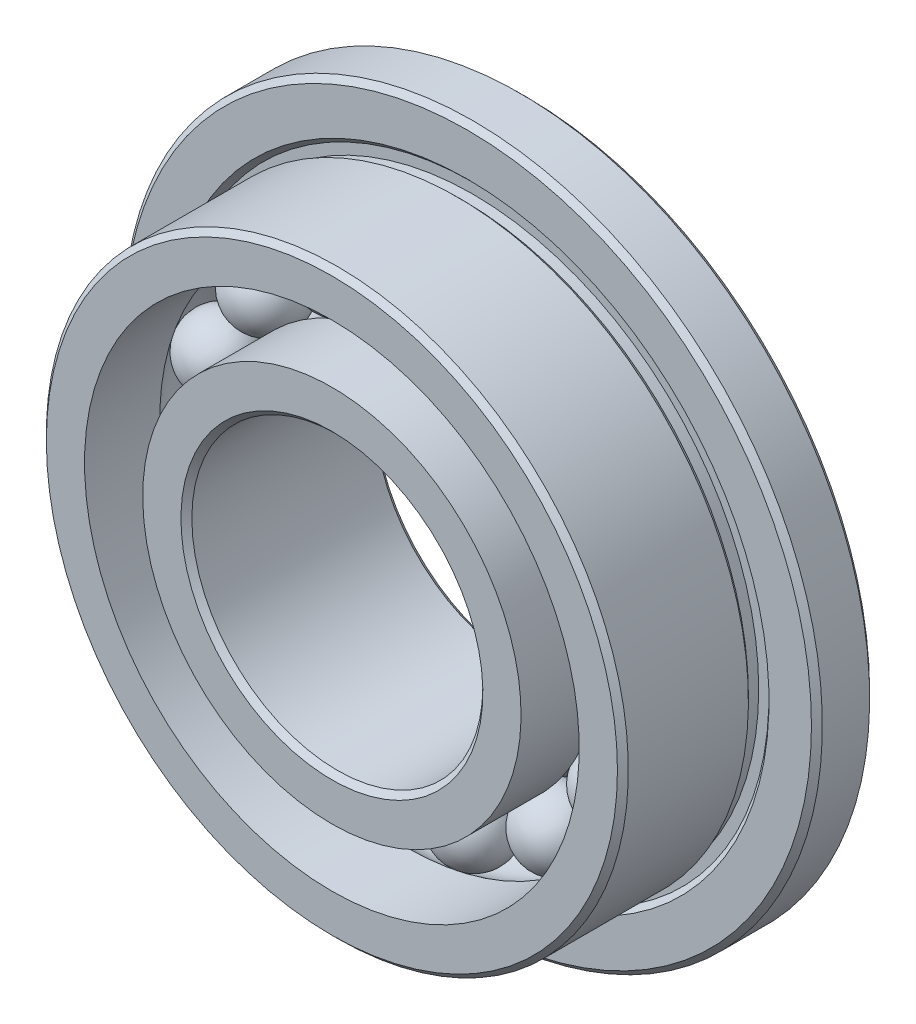
from build123d import *

# Parameters (mm, degrees)
FILLET1_SIZE      = 0.05625
FILLET2_SIZE      = 0.05625
CIRPATTERN3_COUNT = 15


with BuildPart() as part:
    # Sketch2 → Revolve1 (revolve)
    with BuildSketch(Plane(origin=(0, 0, 0), x_dir=(0, 0, -1), z_dir=(1, 0, 0)), mode=Mode.PRIVATE) as revolve1_sk:
        with BuildLine():
            Line((1, 3.6), (0.4, 3.6))
            Line((0.4, 3.6), (0.4, 3.106066017))
            Line((0.4, 3.106066017), (0.453033009, 3.053033009))
            Line((0.453033009, 3.053033009), (0.453033009, 2.946966991))
            Line((0.453033009, 2.946966991), (0.346966991, 2.946966991))
            Line((0.346966991, 2.946966991), (0.293933983, 3))
            Line((0.293933983, 3), (-1, 3))
            Line((-1, 3), (-1, 2.55))
            Line((-1, 2.55), (-0.225, 2.55))
            ThreePointArc((-0.225, 2.55), (0, 2.625), (0.225, 2.55))
            Line((0.225, 2.55), (1, 2.55))
            Line((1, 2.55), (1, 3.6))
        make_face()
        with BuildLine():
            Line((1, 1.5), (-1, 1.5))
            Line((-1, 1.5), (-1, 1.95))
            Line((-1, 1.95), (-0.225, 1.95))
            ThreePointArc((-0.225, 1.95), (0, 1.875), (0.225, 1.95))
            Line((0.225, 1.95), (1, 1.95))
            Line((1, 1.95), (1, 1.5))
        make_face()
    revolve(revolve1_sk.sketch.rotate(Axis((0, 0, 0), (0, 0, -1)), 180), axis=Axis((0, 0, 0), (0, 0, -1)))

    # Fillet1
    fillet1_edges = [part.edges().sort_by_distance(p)[0] for p in [
        (0, 3, 1),
        (0, 3.6, -1),
        (0, 3.6, -0.4),
    ]]
    chamfer(fillet1_edges, length=FILLET1_SIZE)

    # Fillet2
    fillet2_edges = [part.edges().sort_by_distance(p)[0] for p in [
        (0, 1.5, -1),
        (0, 1.5, 1),
    ]]
    chamfer(fillet2_edges, length=FILLET2_SIZE)


with BuildPart() as body_2:
    # Sketch7 → Revolve3 (revolve)
    with BuildSketch(Plane.XY):
        with BuildLine():
            Line((0, 2.625), (0, 1.875))
            ThreePointArc((0, 1.875), (-0.375, 2.25), (0, 2.625))
        make_face()
    revolve(axis=Axis((0, 2.625, 0), (0, -1, 0)))


with BuildPart() as cirpattern3_1:
    # CirPattern3: pattern copy
    add(body_2.part.rotate(Axis((0, 0, 0), (0, 0, 1)), 1 * 360 / CIRPATTERN3_COUNT))


with BuildPart() as cirpattern3_2:
    # CirPattern3: pattern copy
    add(body_2.part.rotate(Axis((0, 0, 0), (0, 0, 1)), 2 * 360 / CIRPATTERN3_COUNT))


with BuildPart() as cirpattern3_3:
    # CirPattern3: pattern copy
    add(body_2.part.rotate(Axis((0, 0, 0), (0, 0, 1)), 3 * 360 / CIRPATTERN3_COUNT))


with BuildPart() as cirpattern3_4:
    # CirPattern3: pattern copy
    add(body_2.part.rotate(Axis((0, 0, 0), (0, 0, 1)), 4 * 360 / CIRPATTERN3_COUNT))


with BuildPart() as cirpattern3_5:
    # CirPattern3: pattern copy
    add(body_2.part.rotate(Axis((0, 0, 0), (0, 0, 1)), 5 * 360 / CIRPATTERN3_COUNT))


with BuildPart() as cirpattern3_6:
    # CirPattern3: pattern copy
    add(body_2.part.rotate(Axis((0, 0, 0), (0, 0, 1)), 6 * 360 / CIRPATTERN3_COUNT))


with BuildPart() as cirpattern3_7:
    # CirPattern3: pattern copy
    add(body_2.part.rotate(Axis((0, 0, 0), (0, 0, 1)), 7 * 360 / CIRPATTERN3_COUNT))


with BuildPart() as cirpattern3_8:
    # CirPattern3: pattern copy
    add(body_2.part.rotate(Axis((0, 0, 0), (0, 0, 1)), 8 * 360 / CIRPATTERN3_COUNT))


with BuildPart() as cirpattern3_9:
    # CirPattern3: pattern copy
    add(body_2.part.rotate(Axis((0, 0, 0), (0, 0, 1)), 9 * 360 / CIRPATTERN3_COUNT))


with BuildPart() as cirpattern3_10:
    # CirPattern3: pattern copy
    add(body_2.part.rotate(Axis((0, 0, 0), (0, 0, 1)), 10 * 360 / CIRPATTERN3_COUNT))


with BuildPart() as cirpattern3_11:
    # CirPattern3: pattern copy
    add(body_2.part.rotate(Axis((0, 0, 0), (0, 0, 1)), 11 * 360 / CIRPATTERN3_COUNT))


with BuildPart() as cirpattern3_12:
    # CirPattern3: pattern copy
    add(body_2.part.rotate(Axis((0, 0, 0), (0, 0, 1)), 12 * 360 / CIRPATTERN3_COUNT))


with BuildPart() as cirpattern3_13:
    # CirPattern3: pattern copy
    add(body_2.part.rotate(Axis((0, 0, 0), (0, 0, 1)), 13 * 360 / CIRPATTERN3_COUNT))


with BuildPart() as cirpattern3_14:
    # CirPattern3: pattern copy
    add(body_2.part.rotate(Axis((0, 0, 0), (0, 0, 1)), 14 * 360 / CIRPATTERN3_COUNT))


solid = Compound([part.part, body_2.part, cirpattern3_1.part, cirpattern3_2.part, cirpattern3_3.part, cirpattern3_4.part, cirpattern3_5.part, cirpattern3_6.part, cirpattern3_7.part, cirpattern3_8.part, cirpattern3_9.part, cirpattern3_10.part, cirpattern3_11.part, cirpattern3_12.part, cirpattern3_13.part, cirpattern3_14.part])
